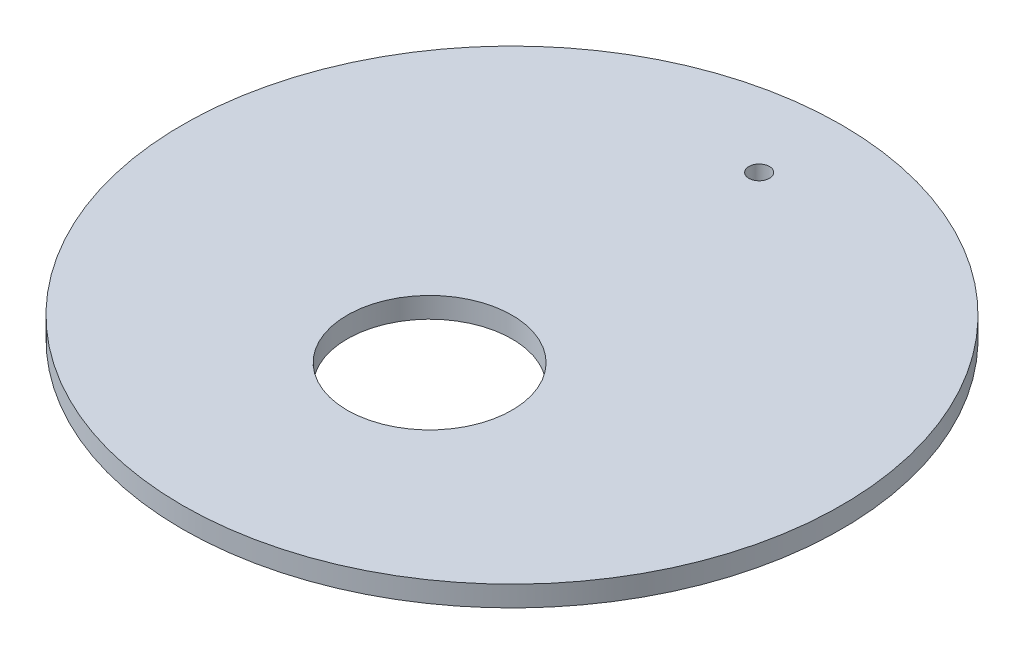
from build123d import *

# Parameters (mm, degrees)
SKETCH1_R           = 101.6
BOSS_EXTRUDE1_DEPTH = 6.35
SKETCH2_R           = 25.4
CUT_EXTRUDE1_DEPTH  = 25.654
SKETCH3_R           = 3.175
CUT_EXTRUDE2_DEPTH  = 25.654


with BuildPart() as part:
    # Sketch1 → Boss-Extrude1 (new body)
    with BuildSketch(Plane(origin=(0, 0, 0), x_dir=(1, 0, 0), z_dir=(0, 1, 0))):
        with Locations(Location((0, 0, 0), (0, 0, 270))):
            Circle(SKETCH1_R)
    extrude(amount=BOSS_EXTRUDE1_DEPTH)

    # Sketch2 → Cut-Extrude1 (cut)
    with BuildSketch(Plane(origin=(0, 6.35, 0), x_dir=(1, 0, 0), z_dir=(0, 1, 0))):
        with Locations(Location((0, -25.4, 0), (0, 0, 270))):
            Circle(SKETCH2_R)
    extrude(amount=-CUT_EXTRUDE1_DEPTH, mode=Mode.SUBTRACT)

    # Sketch3 → Cut-Extrude2 (cut)
    with BuildSketch(Plane(origin=(0, 6.35, 0), x_dir=(1, 0, 0), z_dir=(0, 1, 0))):
        with Locations(Location((0, 76.2, 0), (0, 0, 270))):
            Circle(SKETCH3_R)
    extrude(amount=-CUT_EXTRUDE2_DEPTH, mode=Mode.SUBTRACT)


solid = part.part
